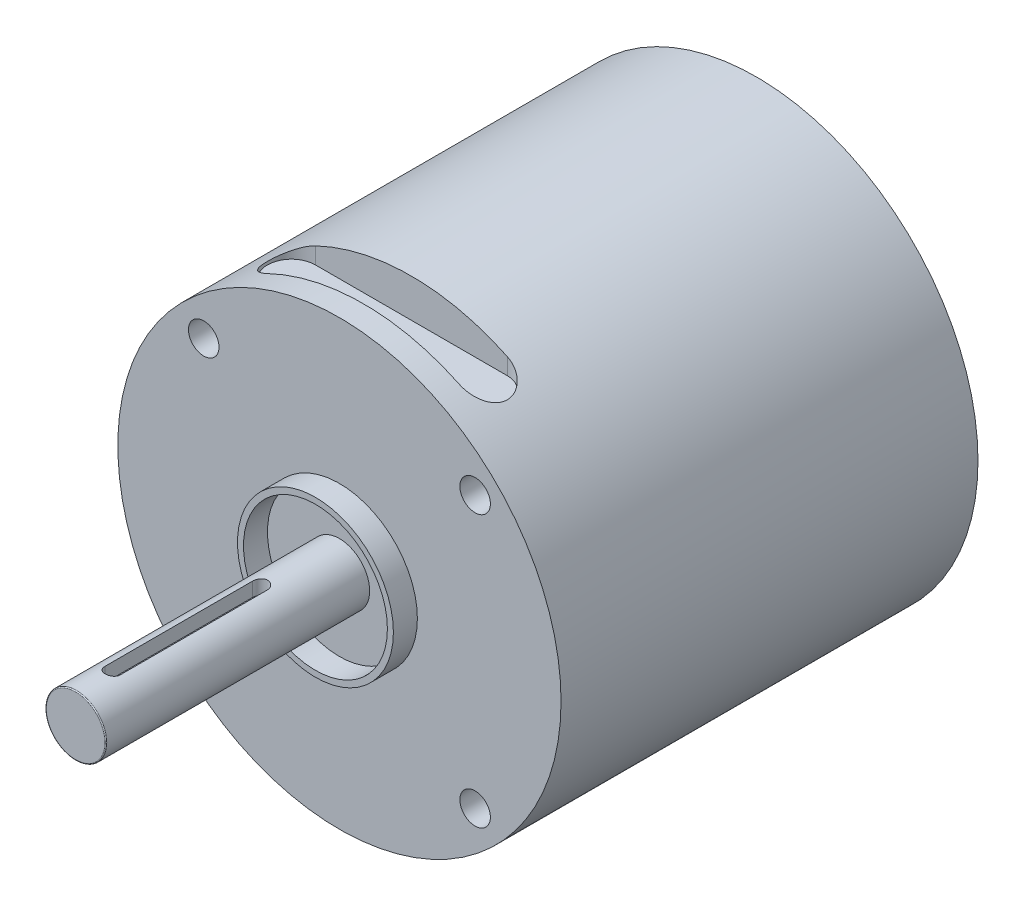
from build123d import *

# Parameters (mm, degrees)
SKETCH1_R           = 29.337
BOSS_EXTRUDE1_DEPTH = 55.1942
SKETCH2_R           = 10.31875
SKETCH2_R_2         = 9.525
BOSS_EXTRUDE2_DEPTH = 3.175
SKETCH3_R           = 4.0005
BOSS_EXTRUDE3_DEPTH = 34.925
SKETCH4_R           = 2.0193
CUT_EXTRUDE1_DEPTH  = 12.7
CUT_EXTRUDE2_DEPTH  = 5.08
CUT_EXTRUDE3_DEPTH  = 2
FILLET1_R           = 0.127


with BuildPart() as part:
    # Sketch1 → Boss-Extrude1 (new body)
    with BuildSketch(Plane.XY):
        Circle(SKETCH1_R)
    extrude(amount=BOSS_EXTRUDE1_DEPTH)

    # Sketch2 → Boss-Extrude2 (add)
    with BuildSketch(Plane.XY.offset(55.1942)):
        Circle(SKETCH2_R)
        Circle(SKETCH2_R_2, mode=Mode.SUBTRACT)
    extrude(amount=BOSS_EXTRUDE2_DEPTH)

    # Sketch3 → Boss-Extrude3 (add)
    with BuildSketch(Plane.XY.offset(55.1942)):
        Circle(SKETCH3_R)
    extrude(amount=BOSS_EXTRUDE3_DEPTH)

    # Sketch4 → Cut-Extrude1 (cut)
    with BuildSketch(Plane.XY.offset(55.1942)):
        with Locations((17.960512242, -17.960512242)):
            Circle(SKETCH4_R)
        with Locations((-17.960512242, -17.960512242)):
            Circle(SKETCH4_R)
        with Locations((-17.960512242, 17.960512242)):
            Circle(SKETCH4_R)
        with Locations((17.960512242, 17.960512242)):
            Circle(SKETCH4_R)
    extrude(amount=-CUT_EXTRUDE1_DEPTH, mode=Mode.SUBTRACT)

    # Sketch5 → Cut-Extrude2 (cut)
    with BuildSketch(Plane(origin=(0, 29.337, 0), x_dir=(1, 0, 0), z_dir=(0, 1, 0))):
        with BuildLine():
            Line((12.7, -52.0192), (-12.7, -52.0192))
            ThreePointArc((-12.7, -52.0192), (-15.875, -48.8442), (-12.7, -45.6692))
            Line((-12.7, -45.6692), (12.7, -45.6692))
            ThreePointArc((12.7, -45.6692), (15.875, -48.8442), (12.7, -52.0192))
        make_face()
    extrude(amount=-CUT_EXTRUDE2_DEPTH, mode=Mode.SUBTRACT)

    # Sketch6 → Cut-Extrude3 (cut)
    with BuildSketch(Plane(origin=(0, 4.0005, 0), x_dir=(1, 0, 0), z_dir=(0, 1, 0))):
        with BuildLine():
            Line((0.99949, -65.71869), (0.99949, -85.21827))
            ThreePointArc((0.99949, -85.21827), (0, -86.21776), (-0.99949, -85.21827))
            Line((-0.99949, -85.21827), (-0.99949, -65.71869))
            ThreePointArc((-0.99949, -65.71869), (0, -64.7192), (0.99949, -65.71869))
        make_face()
    extrude(amount=-CUT_EXTRUDE3_DEPTH, mode=Mode.SUBTRACT)

    # Fillet1
    fillet1_edges = [part.edges().sort_by_distance(p)[0] for p in [
        (-4.0005, 0, 90.1192),
    ]]
    fillet(fillet1_edges, radius=FILLET1_R)


solid = part.part
